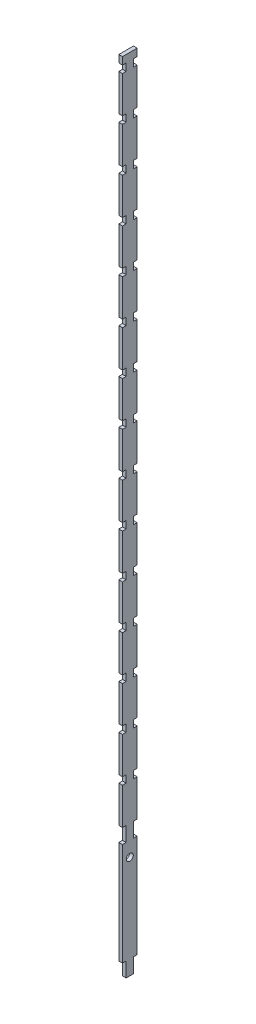
from build123d import *

# Parameters (mm, degrees)
SKETCH1_W           = 1.5875
SKETCH1_H           = 6.35
BOSS_EXTRUDE1_DEPTH = 346.075
SKETCH2_W           = 1.5875
SKETCH2_H           = 6.35
SKETCH2_H_2         = 3.175
CUT_EXTRUDE1_DEPTH  = 347.136892401
SKETCH3_R           = 1.5
CUT_EXTRUDE2_DEPTH  = 10


with BuildPart() as part:
    # Sketch1 → Boss-Extrude1 (new body)
    with BuildSketch(Plane(origin=(0, 0, 0), x_dir=(1, 0, 0), z_dir=(0, 1, 0))):
        with Locations((0.79375, 3.175)):
            Rectangle(SKETCH1_W, SKETCH1_H)
    extrude(amount=BOSS_EXTRUDE1_DEPTH)

    # Sketch2 → Cut-Extrude1 (cut, through all)
    with BuildSketch(Plane.ZY):
        with Locations((-5.55625, 53.975)):
            Rectangle(SKETCH2_W, SKETCH2_H)
        with Locations((-5.55625, 74.6125)):
            Rectangle(SKETCH2_W, SKETCH2_H_2)
        with Locations((-0.79375, 341.3125)):
            Rectangle(SKETCH2_W, SKETCH2_H_2)
        with Locations((-5.55625, 93.6625)):
            Rectangle(SKETCH2_W, SKETCH2_H_2)
        with Locations((-0.79375, 322.2625)):
            Rectangle(SKETCH2_W, SKETCH2_H_2)
        with Locations((-5.55625, 112.7125)):
            Rectangle(SKETCH2_W, SKETCH2_H_2)
        with Locations((-0.79375, 303.2125)):
            Rectangle(SKETCH2_W, SKETCH2_H_2)
        with Locations((-5.55625, 131.7625)):
            Rectangle(SKETCH2_W, SKETCH2_H_2)
        with Locations((-0.79375, 284.1625)):
            Rectangle(SKETCH2_W, SKETCH2_H_2)
        with Locations((-0.79375, 265.1125)):
            Rectangle(SKETCH2_W, SKETCH2_H_2)
        with Locations((-5.55625, 150.8125)):
            Rectangle(SKETCH2_W, SKETCH2_H_2)
        with Locations((-0.79375, 246.0625)):
            Rectangle(SKETCH2_W, SKETCH2_H_2)
        with Locations((-5.55625, 169.8625)):
            Rectangle(SKETCH2_W, SKETCH2_H_2)
        with Locations((-0.79375, 227.0125)):
            Rectangle(SKETCH2_W, SKETCH2_H_2)
        with Locations((-5.55625, 188.9125)):
            Rectangle(SKETCH2_W, SKETCH2_H_2)
        with Locations((-0.79375, 3.175)):
            Rectangle(SKETCH2_W, SKETCH2_H)
        with Locations((-5.55625, 207.9625)):
            Rectangle(SKETCH2_W, SKETCH2_H_2)
        with Locations((-5.55625, 3.175)):
            Rectangle(SKETCH2_W, SKETCH2_H)
        with Locations((-0.79375, 207.9625)):
            Rectangle(SKETCH2_W, SKETCH2_H_2)
        with Locations((-0.79375, 188.9125)):
            Rectangle(SKETCH2_W, SKETCH2_H_2)
        with Locations((-0.79375, 169.8625)):
            Rectangle(SKETCH2_W, SKETCH2_H_2)
        with Locations((-5.55625, 227.0125)):
            Rectangle(SKETCH2_W, SKETCH2_H_2)
        with Locations((-0.79375, 150.8125)):
            Rectangle(SKETCH2_W, SKETCH2_H_2)
        with Locations((-5.55625, 246.0625)):
            Rectangle(SKETCH2_W, SKETCH2_H_2)
        with Locations((-0.79375, 131.7625)):
            Rectangle(SKETCH2_W, SKETCH2_H_2)
        with Locations((-5.55625, 265.1125)):
            Rectangle(SKETCH2_W, SKETCH2_H_2)
        with Locations((-0.79375, 112.7125)):
            Rectangle(SKETCH2_W, SKETCH2_H_2)
        with Locations((-5.55625, 284.1625)):
            Rectangle(SKETCH2_W, SKETCH2_H_2)
        with Locations((-0.79375, 93.6625)):
            Rectangle(SKETCH2_W, SKETCH2_H_2)
        with Locations((-0.79375, 74.6125)):
            Rectangle(SKETCH2_W, SKETCH2_H_2)
        with Locations((-5.55625, 303.2125)):
            Rectangle(SKETCH2_W, SKETCH2_H_2)
        with Locations((-0.79375, 53.975)):
            Rectangle(SKETCH2_W, SKETCH2_H)
        with Locations((-5.55625, 322.2625)):
            Rectangle(SKETCH2_W, SKETCH2_H_2)
        with Locations((-5.55625, 341.3125)):
            Rectangle(SKETCH2_W, SKETCH2_H_2)
    extrude(amount=-CUT_EXTRUDE1_DEPTH, mode=Mode.SUBTRACT)

    # Sketch3 → Cut-Extrude2 (cut)
    with BuildSketch(Plane.ZY):
        with Locations((-3.175, 44.45)):
            Circle(SKETCH3_R)
    extrude(amount=-CUT_EXTRUDE2_DEPTH, mode=Mode.SUBTRACT)


solid = part.part
